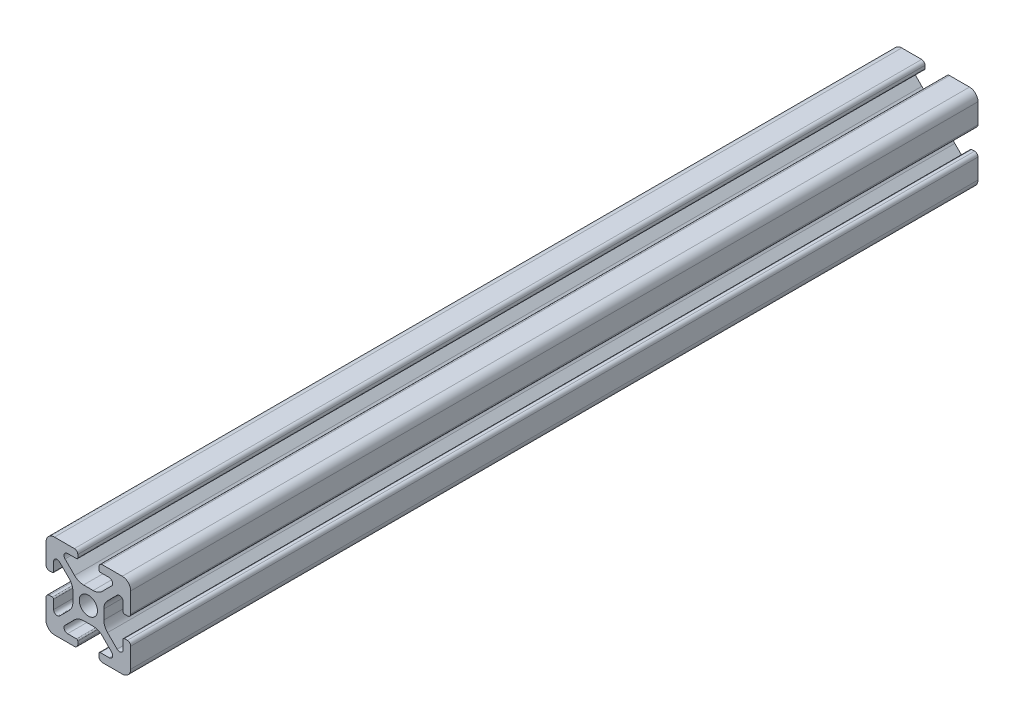
from build123d import *

# Parameters (mm, degrees)
BOSS_EXTRU_1_DEPTH = 200


with BuildPart() as part:
    # Esquisse1 → Boss.-Extru.1 (new body)
    with BuildSketch(Plane.XY):
        with BuildLine():
            Line((-3.255887446, 4.528679645), (-5.506192286, 6.778984485))
            ThreePointArc((-5.506192286, 6.778984485), (-5.686636441, 7.686138511), (-4.917588391, 8.199999989))
            Line((-4.917588391, 8.199999989), (-2.799999991, 8.199999989))
            ThreePointArc((-2.799999991, 8.199999989), (-2.587867957, 8.287867955), (-2.499999991, 8.499999989))
            Line((-2.499999991, 8.499999989), (-2.499999991, 9.199999989))
            ThreePointArc((-2.499999991, 9.199999989), (-2.734314566, 9.765685414), (-3.299999991, 9.999999989))
            Line((-3.299999991, 9.999999989), (-7.999999991, 9.999999989))
            ThreePointArc((-7.999999991, 9.999999989), (-9.414213554, 9.414213552), (-9.999999991, 7.999999989))
            Line((-9.999999991, 7.999999989), (-9.999999991, 3.299999989))
            ThreePointArc((-9.999999991, 3.299999989), (-9.765685416, 2.734314564), (-9.199999991, 2.499999989))
            Line((-9.199999991, 2.499999989), (-8.499999991, 2.499999989))
            ThreePointArc((-8.499999991, 2.499999989), (-8.287867957, 2.587867955), (-8.199999991, 2.799999989))
            Line((-8.199999991, 2.799999989), (-8.199999991, 4.917588389))
            ThreePointArc((-8.199999991, 4.917588389), (-7.686138517, 5.686636433), (-6.778984497, 5.506192279))
            Line((-6.778984497, 5.506192279), (-4.528679657, 3.255887439))
            ThreePointArc((-4.528679657, 3.255887439), (-3.878361403, 2.282617393), (-3.650000001, 1.134567096))
            Line((-3.650000001, 1.134567096), (-3.650000001, -1.134567114))
            ThreePointArc((-3.650000001, -1.134567114), (-3.878361403, -2.282617409), (-4.528679656, -3.255887454))
            Line((-4.528679656, -3.255887454), (-6.778984496, -5.506192294))
            ThreePointArc((-6.778984496, -5.506192294), (-7.686138522, -5.686636449), (-8.2, -4.9175884))
            Line((-8.2, -4.9175884), (-8.2, -2.8))
            ThreePointArc((-8.2, -2.8), (-8.287867966, -2.587867966), (-8.5, -2.5))
            Line((-8.5, -2.5), (-9.2, -2.5))
            ThreePointArc((-9.2, -2.5), (-9.765685425, -2.734314575), (-10, -3.3))
            Line((-10, -3.3), (-10, -8))
            ThreePointArc((-10, -8), (-9.414213562, -9.414213562), (-8, -10))
            Line((-8, -10), (-3.3, -10))
            ThreePointArc((-3.3, -10), (-2.734314575, -9.765685425), (-2.5, -9.2))
            Line((-2.5, -9.2), (-2.5, -8.5))
            ThreePointArc((-2.5, -8.5), (-2.587867966, -8.287867966), (-2.8, -8.2))
            Line((-2.8, -8.2), (-4.9175884, -8.2))
            ThreePointArc((-4.9175884, -8.2), (-5.686636444, -7.686138526), (-5.50619229, -6.778984506))
            Line((-5.50619229, -6.778984506), (-3.25588745, -4.528679666))
            ThreePointArc((-3.25588745, -4.528679666), (-2.282617404, -3.878361412), (-1.134567106, -3.650000009))
            Line((-1.134567106, -3.650000009), (1.134567104, -3.650000009))
            ThreePointArc((1.134567104, -3.650000009), (2.282617399, -3.878361412), (3.255887444, -4.528679664))
            Line((3.255887444, -4.528679664), (5.506192284, -6.778984504))
            ThreePointArc((5.506192284, -6.778984504), (5.686636439, -7.686138531), (4.917588389, -8.200000009))
            Line((4.917588389, -8.200000009), (2.799999989, -8.200000009))
            ThreePointArc((2.799999989, -8.200000009), (2.587867955, -8.287867974), (2.499999989, -8.500000009))
            Line((2.499999989, -8.500000009), (2.499999989, -9.200000009))
            ThreePointArc((2.499999989, -9.200000009), (2.734314564, -9.765685434), (3.299999989, -10.000000009))
            Line((3.299999989, -10.000000009), (7.999999989, -10.000000009))
            ThreePointArc((7.999999989, -10.000000009), (9.414213552, -9.414213571), (9.999999989, -8.000000009))
            Line((9.999999989, -8.000000009), (9.999999989, -3.300000009))
            ThreePointArc((9.999999989, -3.300000009), (9.765685414, -2.734314584), (9.199999989, -2.500000009))
            Line((9.199999989, -2.500000009), (8.499999989, -2.500000009))
            ThreePointArc((8.499999989, -2.500000009), (8.287867955, -2.587867974), (8.199999989, -2.800000009))
            Line((8.199999989, -2.800000009), (8.199999989, -4.917588409))
            ThreePointArc((8.199999989, -4.917588409), (7.686138515, -5.686636452), (6.778984495, -5.506192299))
            Line((6.778984495, -5.506192299), (4.528679655, -3.255887459))
            ThreePointArc((4.528679655, -3.255887459), (3.878361401, -2.282617412), (3.649999999, -1.134567115))
            Line((3.649999999, -1.134567115), (3.649999999, 1.134567095))
            ThreePointArc((3.649999999, 1.134567095), (3.878361401, 2.28261739), (4.528679654, 3.255887435))
            Line((4.528679654, 3.255887435), (6.778984494, 5.506192275))
            ThreePointArc((6.778984494, 5.506192275), (7.68613852, 5.68663643), (8.199999998, 4.917588381))
            Line((8.199999998, 4.917588381), (8.199999998, 2.799999981))
            ThreePointArc((8.199999998, 2.799999981), (8.287867964, 2.587867946), (8.499999998, 2.499999981))
            Line((8.499999998, 2.499999981), (9.199999998, 2.499999981))
            ThreePointArc((9.199999998, 2.499999981), (9.765685423, 2.734314556), (9.999999998, 3.299999981))
            Line((9.999999998, 3.299999981), (9.999999998, 7.999999981))
            ThreePointArc((9.999999998, 7.999999981), (9.41421356, 9.414213543), (7.999999998, 9.999999981))
            Line((7.999999998, 9.999999981), (3.299999998, 9.999999981))
            ThreePointArc((3.299999998, 9.999999981), (2.734314573, 9.765685406), (2.499999998, 9.199999981))
            Line((2.499999998, 9.199999981), (2.499999998, 8.499999981))
            ThreePointArc((2.499999998, 8.499999981), (2.587867964, 8.287867946), (2.799999998, 8.199999981))
            Line((2.799999998, 8.199999981), (4.917588398, 8.199999981))
            ThreePointArc((4.917588398, 8.199999981), (5.686636442, 7.686138507), (5.506192288, 6.778984487))
            Line((5.506192288, 6.778984487), (3.255887448, 4.528679647))
            ThreePointArc((3.255887448, 4.528679647), (2.282617402, 3.878361393), (1.134567104, 3.64999999))
            Line((1.134567104, 3.64999999), (-1.134567106, 3.64999999))
            ThreePointArc((-1.134567106, 3.64999999), (-2.282617401, 3.878361392), (-3.255887446, 4.528679645))
        make_face()
        with BuildLine():
            ThreePointArc((-2.15, 0), (0, -2.15), (2.15, 0))
            ThreePointArc((2.15, 0), (0, 2.15), (-2.15, 0))
        make_face(mode=Mode.SUBTRACT)
    extrude(amount=BOSS_EXTRU_1_DEPTH)


solid = part.part
